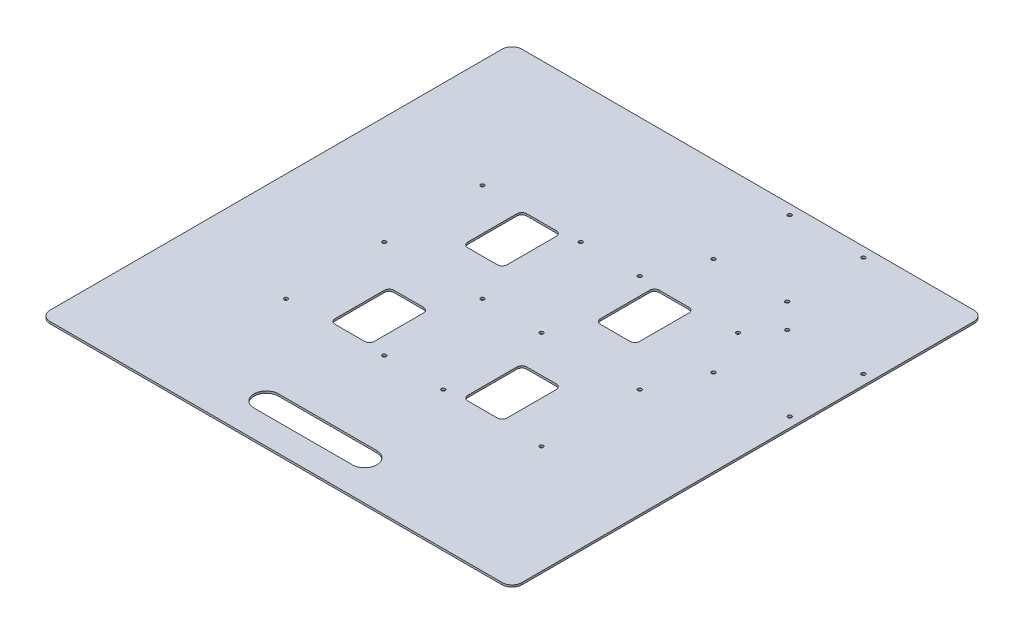
from build123d import *

# Parameters (mm, degrees)
SKETCH1_W                        = 609.6
SKETCH1_H                        = 609.6
BOSS_EXTRUDE1_DEPTH              = 2.65684
CUT_EXTRUDE1_DEPTH               = 432.060481602
SKETCH3_R                        = 2.3876
CUT_EXTRUDE2_DEPTH               = 432.060481602
LPATTERN1_COUNT                  = 2
LPATTERN1_PITCH                  = 203.2
CUT_EXTRUDE3_DEPTH               = 432.060481602
FILLET1_R                        = 12.7
SKETCH5_R                        = 2.3876
CUT_EXTRUDE4_DEPTH               = 432.060481602
F_10_0_1935_DIAMETER_HOLE1_D     = 4.9149
F_10_0_1935_DIAMETER_HOLE1_DEPTH = 2.65684


with BuildPart() as part:
    # Sketch1 → Boss-Extrude1 (new body)
    with BuildSketch(Plane(origin=(0, 0, 0), x_dir=(1, 0, 0), z_dir=(0, 1, 0))):
        Rectangle(SKETCH1_W, SKETCH1_H)
    extrude(amount=BOSS_EXTRUDE1_DEPTH)

    # Sketch2 → Cut-Extrude1 (cut, through all)
    with BuildSketch(Plane(origin=(0, 2.65684, 0), x_dir=(1, 0, 0), z_dir=(0, 1, 0))):
        with BuildLine():
            Line((-104.775, 123.825), (-66.675, 123.825))
            ThreePointArc((-66.675, 123.825), (-62.184871939, 121.965128061), (-60.325, 117.475))
            Line((-60.325, 117.475), (-60.325, 53.975))
            ThreePointArc((-60.325, 53.975), (-62.184871939, 49.484871939), (-66.675, 47.625))
            Line((-66.675, 47.625), (-104.775, 47.625))
            ThreePointArc((-104.775, 47.625), (-109.265128061, 49.484871939), (-111.125, 53.975))
            Line((-111.125, 53.975), (-111.125, 117.475))
            ThreePointArc((-111.125, 117.475), (-109.265128061, 121.965128061), (-104.775, 123.825))
        make_face()
        with BuildLine():
            Line((-104.775, -47.625), (-66.675, -47.625))
            ThreePointArc((-66.675, -47.625), (-62.184871939, -49.484871939), (-60.325, -53.975))
            Line((-60.325, -53.975), (-60.325, -117.475))
            ThreePointArc((-60.325, -117.475), (-62.184871939, -121.965128061), (-66.675, -123.825))
            Line((-66.675, -123.825), (-104.775, -123.825))
            ThreePointArc((-104.775, -123.825), (-109.265128061, -121.965128061), (-111.125, -117.475))
            Line((-111.125, -117.475), (-111.125, -53.975))
            ThreePointArc((-111.125, -53.975), (-109.265128061, -49.484871939), (-104.775, -47.625))
        make_face()
        with BuildLine():
            Line((66.675, -47.625), (104.775, -47.625))
            ThreePointArc((104.775, -47.625), (109.265128061, -49.484871939), (111.125, -53.975))
            Line((111.125, -53.975), (111.125, -117.475))
            ThreePointArc((111.125, -117.475), (109.265128061, -121.965128061), (104.775, -123.825))
            Line((104.775, -123.825), (66.675, -123.825))
            ThreePointArc((66.675, -123.825), (62.184871939, -121.965128061), (60.325, -117.475))
            Line((60.325, -117.475), (60.325, -53.975))
            ThreePointArc((60.325, -53.975), (62.184871939, -49.484871939), (66.675, -47.625))
        make_face()
        with BuildLine():
            Line((104.775, 123.825), (66.675, 123.825))
            ThreePointArc((66.675, 123.825), (62.184871939, 121.965128061), (60.325, 117.475))
            Line((60.325, 117.475), (60.325, 53.975))
            ThreePointArc((60.325, 53.975), (62.184871939, 49.484871939), (66.675, 47.625))
            Line((66.675, 47.625), (104.775, 47.625))
            ThreePointArc((104.775, 47.625), (109.265128061, 49.484871939), (111.125, 53.975))
            Line((111.125, 53.975), (111.125, 117.475))
            ThreePointArc((111.125, 117.475), (109.265128061, 121.965128061), (104.775, 123.825))
        make_face()
    extrude(amount=-CUT_EXTRUDE1_DEPTH, mode=Mode.SUBTRACT)

    # Sketch3 → Cut-Extrude2 (cut, through all)
    with BuildSketch(Plane(origin=(0, 2.65684, 0), x_dir=(1, 0, 0), z_dir=(0, 1, 0))):
        with Locations((-165.1, 127)):
            Circle(SKETCH3_R)
        with Locations((-165.1, 0)):
            Circle(SKETCH3_R)
        with Locations((-165.1, -127)):
            Circle(SKETCH3_R)
        with Locations((-38.1, 127)):
            Circle(SKETCH3_R)
        with Locations((-38.1, 0)):
            Circle(SKETCH3_R)
        with Locations((-38.1, -127)):
            Circle(SKETCH3_R)
    cut_extrude2 = extrude(amount=-CUT_EXTRUDE2_DEPTH, mode=Mode.SUBTRACT)

    # LPattern1: Cut-Extrude2 ×2
    with Locations(*[(i * LPATTERN1_PITCH, 0, 0) for i in range(1, LPATTERN1_COUNT)]):
        add(cut_extrude2, mode=Mode.SUBTRACT)

    # Sketch4 → Cut-Extrude3 (cut, through all)
    with BuildSketch(Plane(origin=(0, 2.65684, 0), x_dir=(1, 0, 0), z_dir=(0, 1, 0))):
        with BuildLine():
            Line((-63.5, -238.125), (63.5, -238.125))
            ThreePointArc((63.5, -238.125), (79.375, -254), (63.5, -269.875))
            Line((63.5, -269.875), (-63.5, -269.875))
            ThreePointArc((-63.5, -269.875), (-79.375, -254), (-63.5, -238.125))
        make_face()
    extrude(amount=-CUT_EXTRUDE3_DEPTH, mode=Mode.SUBTRACT)

    # Fillet1
    fillet1_edges = [part.edges().sort_by_distance(p)[0] for p in [
        (-304.8, 1.32842, 304.8),
        (304.8, 1.32842, 304.8),
        (-304.8, 1.32842, -304.8),
        (304.8, 1.32842, -304.8),
    ]]
    fillet(fillet1_edges, radius=FILLET1_R)

    # Sketch5 → Cut-Extrude4 (cut, through all)
    with BuildSketch(Plane(origin=(0, 2.65684, 0), x_dir=(1, 0, 0), z_dir=(0, 1, 0))):
        with Locations((161.925, 292.1)):
            Circle(SKETCH5_R)
        with Locations((66.675, 292.1)):
            Circle(SKETCH5_R)
        with Locations((161.925, 193.675)):
            Circle(SKETCH5_R)
        with Locations((66.675, 193.675)):
            Circle(SKETCH5_R)
        with Locations((193.675, 161.925)):
            Circle(SKETCH5_R)
        with Locations((193.675, 66.675)):
            Circle(SKETCH5_R)
        with Locations((292.1, 66.675)):
            Circle(SKETCH5_R)
        with Locations((292.1, 161.925)):
            Circle(SKETCH5_R)
    extrude(amount=-CUT_EXTRUDE4_DEPTH, mode=Mode.SUBTRACT)

    # #10 (0.1935) Diameter Hole1
    with Locations(Plane(origin=(0, 2.65684, 0), x_dir=(1, 0, 0), z_dir=(0, 1, 0))):
        with Locations((161.925, 292.1), (66.675, 292.1), (292.1, 161.925), (193.675, 161.925), (161.925, 193.675), (66.675, 193.675), (165.1, 127), (38.1, 127), (-38.1, 127), (292.1, 66.675), (193.675, 66.675), (165.1, 0), (165.1, -127), (-38.1, 0), (38.1, 0), (38.1, -127), (-38.1, -127), (-165.1, -127), (-165.1, 0), (-165.1, 127)):
            Hole(F_10_0_1935_DIAMETER_HOLE1_D / 2, depth=F_10_0_1935_DIAMETER_HOLE1_DEPTH)


solid = part.part
